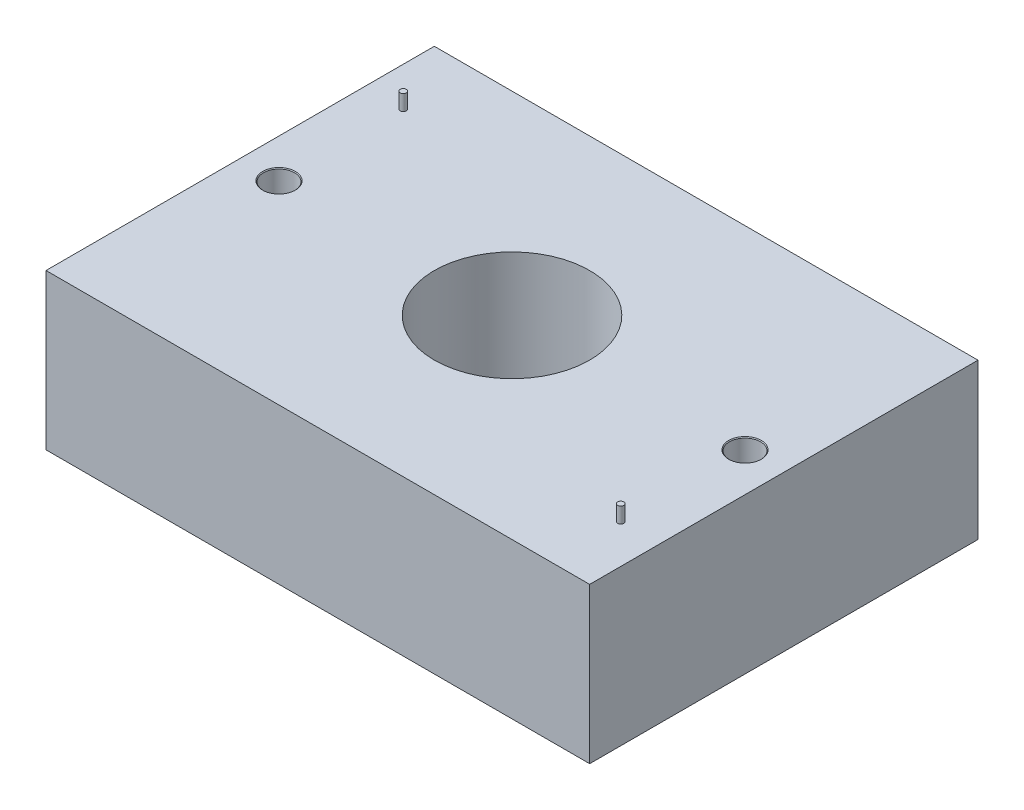
from build123d import *

# Parameters (mm, degrees)
SKETCH1_W                                      = 175
SKETCH1_H                                      = 125
SKETCH1_R                                      = 25
BOSS_EXTRUDE1_DEPTH                            = 50
SKETCH1_4_R                                    = 1
BOSS_EXTRUDE2_DEPTH                            = 5
CBORE_FOR_M12_HEX_HEAD_MACHINE_SCREW1_AT_COUNT = 2
CBORE_FOR_M12_HEX_HEAD_MACHINE_SCREW1_AT_PITCH = 150


with BuildPart() as part:
    # Sketch1 → Boss-Extrude1 (new body)
    with BuildSketch(Plane(origin=(0, 0, 0), x_dir=(1, 0, 0), z_dir=(0, 1, 0))):
        with Locations((87.5, 62.5)):
            Rectangle(SKETCH1_W, SKETCH1_H)
        with Locations((87.5, 62.5)):
            Circle(SKETCH1_R, mode=Mode.SUBTRACT)
    extrude(amount=-BOSS_EXTRUDE1_DEPTH)

    # Sketch1<4> → Boss-Extrude2 (add)
    with BuildSketch(Plane(origin=(0, 0, 0), x_dir=(1, 0, 0), z_dir=(0, 1, 0))):
        with Locations((162.5, 22.5)):
            Circle(SKETCH1_4_R)
        with Locations((12.5, 102.5)):
            Circle(SKETCH1_4_R)
    extrude(amount=BOSS_EXTRUDE2_DEPTH)

    # Sketch5 → CBORE for M12 Hex Head Machine Screw1 (revolve, cut)
    with BuildSketch(Plane(origin=(12.5, 0, -62.5), x_dir=(0, 0, 1), z_dir=(1, 0, 0))):
        Polygon((0, 0), (0, 28), (4.25, 25.446342369), (4.25, 20), (5, 20), (5, 0.25), (5.25, 0), align=None)
    cbore_for_m12_hex_head_machine_screw1 = revolve(axis=Axis((12.5, 6.35, -62.5), (0, -1, 0)), mode=Mode.SUBTRACT)

    # CBORE for M12 Hex Head Machine Screw1 at: CBORE for M12 Hex Head Machine Screw1 ×2
    with Locations(*[(i * CBORE_FOR_M12_HEX_HEAD_MACHINE_SCREW1_AT_PITCH, 0, 0) for i in range(1, CBORE_FOR_M12_HEX_HEAD_MACHINE_SCREW1_AT_COUNT)]):
        add(cbore_for_m12_hex_head_machine_screw1, mode=Mode.SUBTRACT)


solid = part.part
